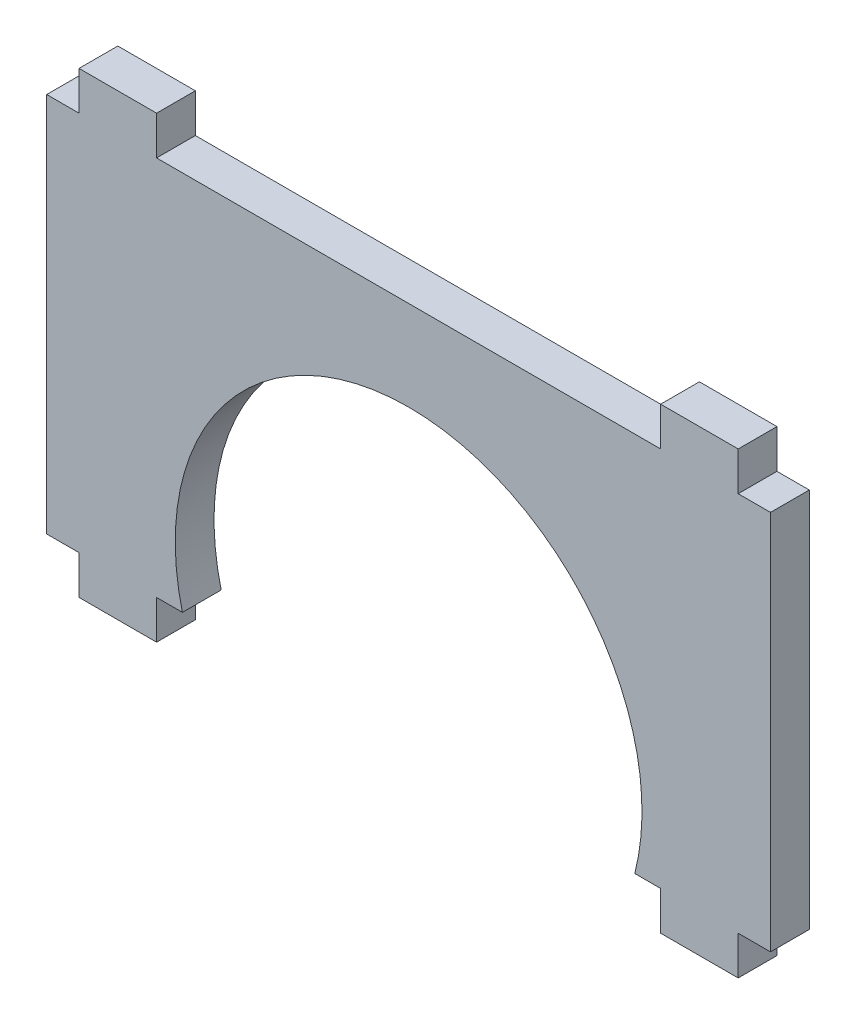
from build123d import *

# Parameters (mm, degrees)
BOSS_EXTRUDE1_DEPTH = 3


with BuildPart() as part:
    # Sketch1 → Boss-Extrude1 (new body)
    with BuildSketch(Plane.XY):
        with BuildLine():
            Line((-28, 14.725), (-28, -14.725))
            Line((-28, -14.725), (-25.5, -14.725))
            Line((-25.5, -14.725), (-25.5, -17.725))
            Line((-25.5, -17.725), (-19.5, -17.725))
            Line((-19.5, -17.725), (-19.5, -14.725))
            Line((-19.5, -14.725), (-17.5, -14.725))
            ThreePointArc((-17.5, -14.725), (0, 7.78192388), (17.5, -14.725))
            Line((17.5, -14.725), (19.5, -14.725))
            Line((19.5, -14.725), (19.5, -17.725))
            Line((19.5, -17.725), (25.5, -17.725))
            Line((25.5, -17.725), (25.5, -14.725))
            Line((25.5, -14.725), (28, -14.725))
            Line((28, -14.725), (28, 14.725))
            Line((28, 14.725), (25.5, 14.725))
            Line((25.5, 14.725), (25.5, 17.725))
            Line((25.5, 17.725), (19.5, 17.725))
            Line((19.5, 17.725), (19.5, 14.725))
            Line((19.5, 14.725), (-19.5, 14.725))
            Line((-19.5, 14.725), (-19.5, 17.725))
            Line((-19.5, 17.725), (-25.5, 17.725))
            Line((-25.5, 17.725), (-25.5, 14.725))
            Line((-25.5, 14.725), (-28, 14.725))
        make_face()
    extrude(amount=BOSS_EXTRUDE1_DEPTH)


solid = part.part
